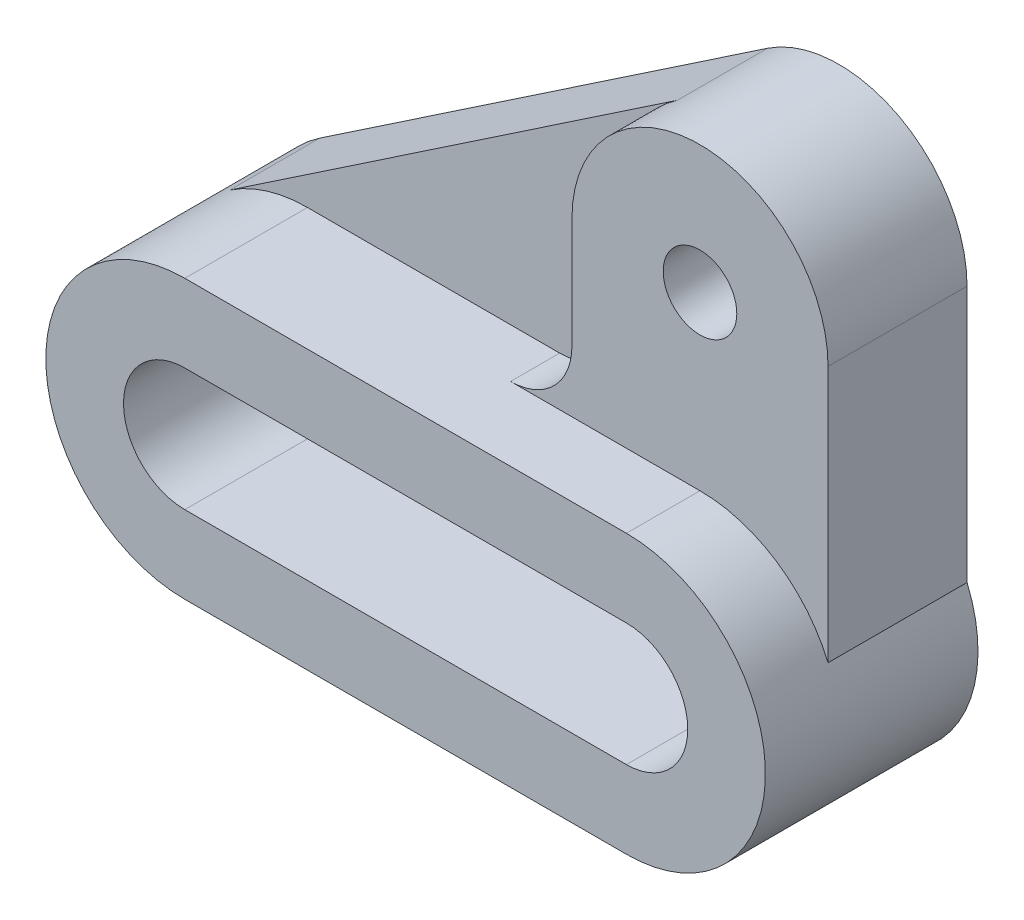
from build123d import *

# Parameters (mm, degrees)
BOSS_EXTRUDE1_DEPTH             = 52
BOSS_EXTRUDE2_DEPTH             = 22
BOSS_EXTRUDE3_DEPTH             = 12
F_1_0MM_CLEARANCE_DOWEL_HOLE1_D = 18
FILLET1_R                       = 15


with BuildPart() as part:
    # Sketch1 → Boss-Extrude1 (new body)
    with BuildSketch(Plane.XY):
        with BuildLine():
            Line((0, -34), (-108, -34))
            ThreePointArc((-108, -34), (-142, 0), (-108, 34))
            Line((-108, 34), (0, 34))
            ThreePointArc((0, 34), (34, 0), (0, -34))
        make_face()
        with BuildLine():
            Line((0, -15), (-108, -15))
            ThreePointArc((-108, -15), (-123, 0), (-108, 15))
            Line((-108, 15), (0, 15))
            ThreePointArc((0, 15), (15, 0), (0, -15))
        make_face(mode=Mode.SUBTRACT)
    extrude(amount=BOSS_EXTRUDE1_DEPTH)

    # Sketch2 → Boss-Extrude2 (add)
    with BuildSketch(Plane.XY):
        with BuildLine():
            Line((-126.998451924, 28.196787485), (0, 28.196787485))
            Line((0, 28.196787485), (31.319910556, 13.231145179))
            Line((31.319910556, 13.231145179), (31.319910556, 76))
            ThreePointArc((31.319910556, 76), (14.710725641, 103.650160006), (-17.500876911, 101.974143))
            Line((-17.500876911, 101.974143), (-126.998451924, 28.196787485))
        make_face()
    extrude(amount=BOSS_EXTRUDE2_DEPTH)

    # Sketch3 → Boss-Extrude3 (add)
    with BuildSketch(Plane.XY.offset(22)):
        with BuildLine():
            Line((-31.319910556, 76), (-31.319910556, 27.253285183))
            Line((-31.319910556, 27.253285183), (31.319910556, 13.231145179))
            Line((31.319910556, 13.231145179), (31.319910556, 76))
            ThreePointArc((31.319910556, 76), (0, 107.319910556), (-31.319910556, 76))
        make_face()
    extrude(amount=BOSS_EXTRUDE3_DEPTH)

    # Ø1.0mm Clearance Dowel Hole1 (through all)
    with Locations(Plane.XY.offset(34)):
        with Locations((0, 76)):
            Hole(F_1_0MM_CLEARANCE_DOWEL_HOLE1_D / 2)

    # Fillet1
    fillet1_edges = [part.edges().sort_by_distance(p)[0] for p in [
        (-31.319910556, 34, 28),
    ]]
    fillet(fillet1_edges, radius=FILLET1_R)


solid = part.part
